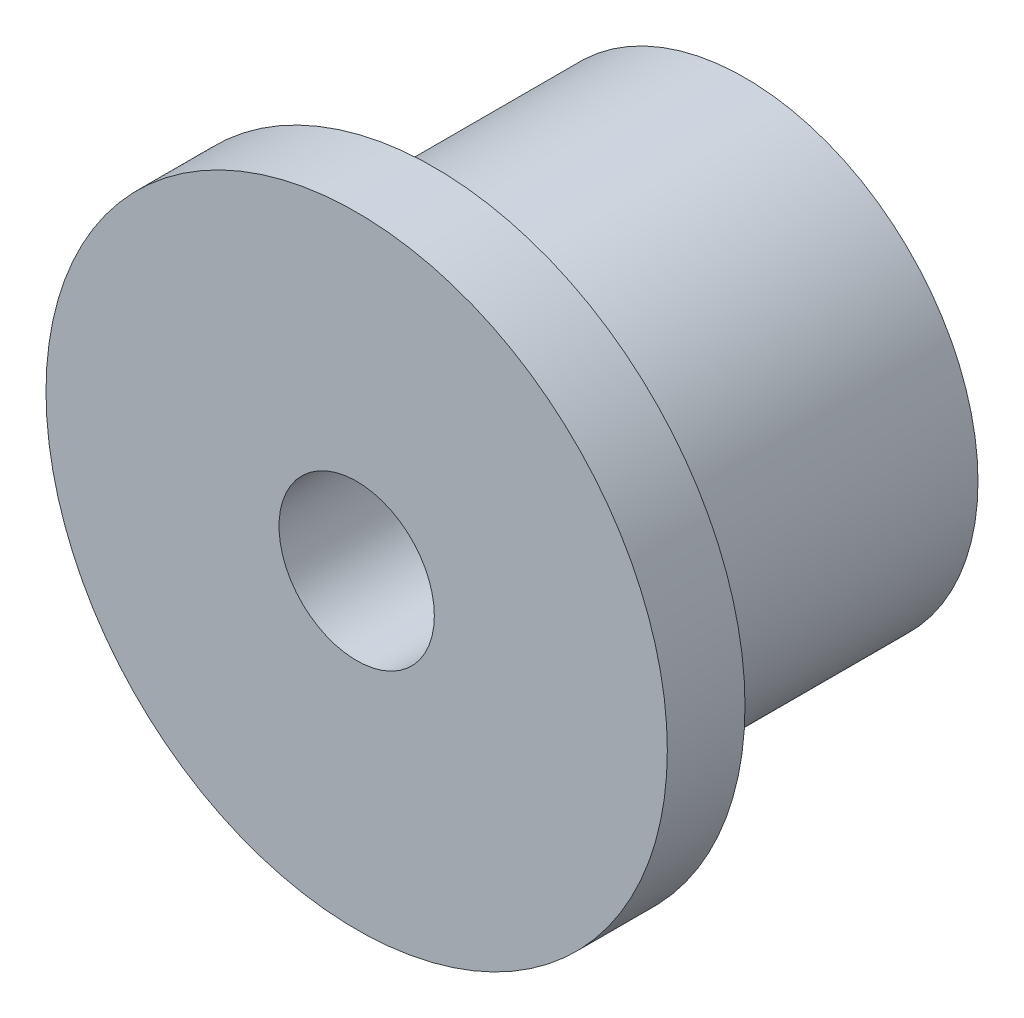
from build123d import *

# Parameters (mm, degrees)
SKETCH1_R           = 25.4
BOSS_EXTRUDE2_DEPTH = 6.35
SKETCH2_R           = 19.05
BOSS_EXTRUDE3_DEPTH = 25.4
SKETCH3_R           = 6.35
CUT_EXTRUDE2_DEPTH  = 48.941448664


with BuildPart() as part:
    # Sketch1 → Boss-Extrude2 (new body)
    with BuildSketch(Plane.XY):
        Circle(SKETCH1_R)
    extrude(amount=-BOSS_EXTRUDE2_DEPTH)

    # Sketch2 → Boss-Extrude3 (add)
    with BuildSketch(Plane(origin=(0, 0, -6.35), x_dir=(-1, 0, 0), z_dir=(0, 0, -1))):
        Circle(SKETCH2_R)
    extrude(amount=BOSS_EXTRUDE3_DEPTH)

    # Sketch3 → Cut-Extrude2 (cut, through all)
    with BuildSketch(Plane.XY):
        Circle(SKETCH3_R)
    extrude(amount=-CUT_EXTRUDE2_DEPTH, mode=Mode.SUBTRACT)


solid = part.part
